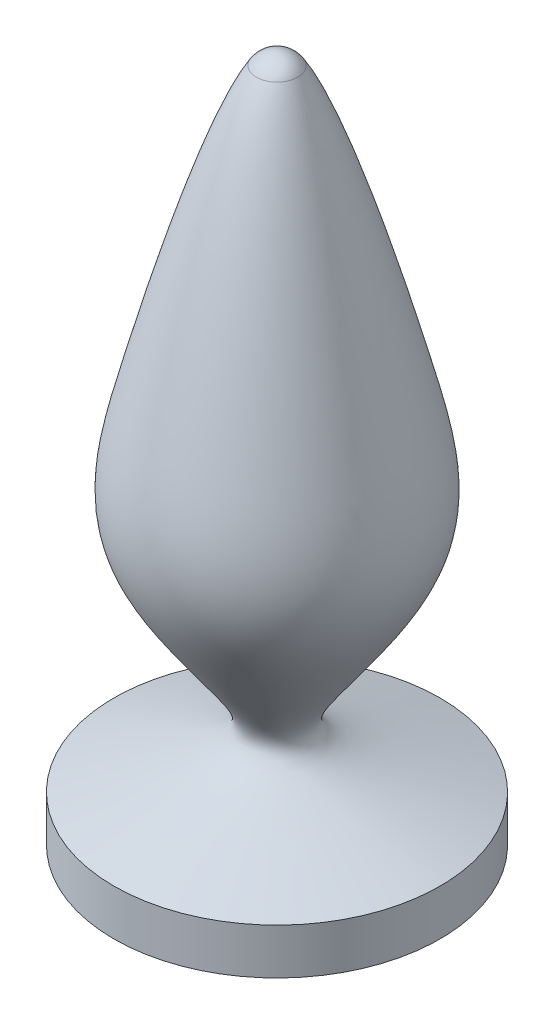
from build123d import *


with BuildPart() as part:
    # Sketch1 → Revolve1 (revolve)
    with BuildSketch(Plane.XY):
        with BuildLine():
            Line((0, -71.377172013), (0, 0))
            ThreePointArc((0, 0), (1.223734169, -0.314224925), (2.144690561, -1.179153793))
            add(Edge.make_bspline(
                [(2.144690561, -1.179153793), (4.702836967, -5.210786776), (8.980430624, -18.882117933), (14.526020339, -40.98152643), (12.273942801, -46.216037015), (1.142592659, -61.924501885), (0.808405214, -60.947926468), (16.9545, -66.614672013)],
                knots=[0.105965392, 0.105965392, 0.105965392, 0.105965392, 0.448012953, 0.508175246, 0.685431315, 0.718366342, 1, 1, 1, 1], degree=3))
            Line((16.9545, -66.614672013), (16.9545, -71.377172013))
            Line((16.9545, -71.377172013), (0, -71.377172013))
        make_face()
    revolve(axis=Axis((0, -71.377172013, 0), (0, 1, 0)))


solid = part.part
